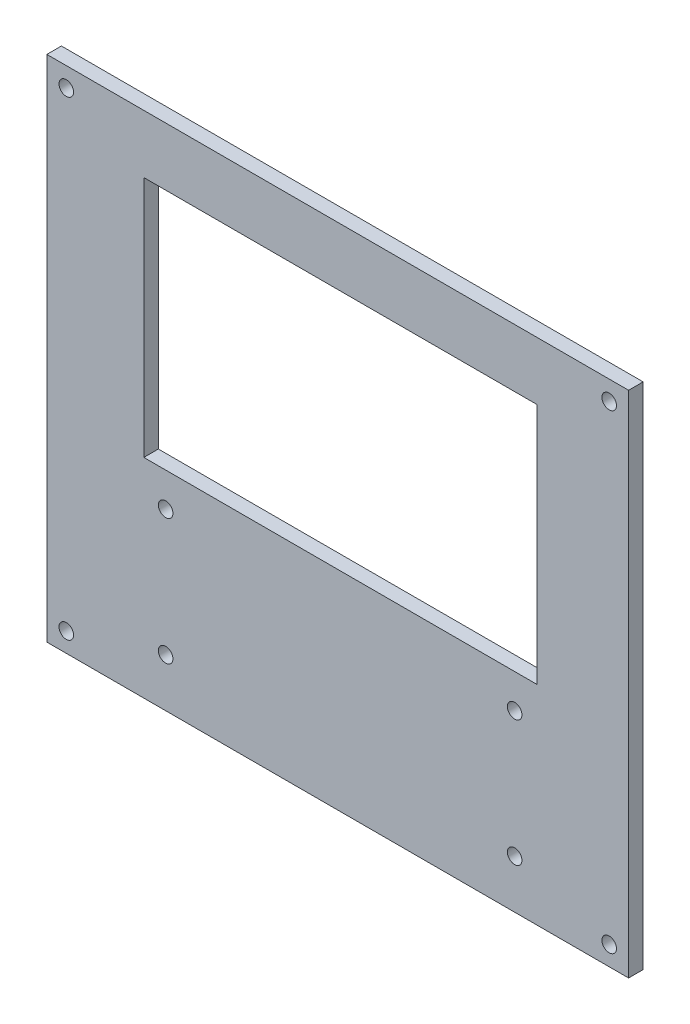
from build123d import *

# Parameters (mm, degrees)
SKETCH_1_W          = 120
SKETCH_1_H          = 105
EXTRUDE_1_DEPTH     = 3
SKETCH_2_R          = 1.5
CUT_EXTRUDE_1_DEPTH = 10
SKETCH_3_R          = 1.5
SKETCH_3_W          = 81.151446905
SKETCH_3_H          = 50
CUT_EXTRUDE_2_DEPTH = 10


with BuildPart() as part:
    # 草图1 → 凸台-拉伸1 (new body)
    with BuildSketch(Plane.XY):
        Rectangle(SKETCH_1_W, SKETCH_1_H)
    extrude(amount=EXTRUDE_1_DEPTH)

    # 草图2 → 切除-拉伸1 (cut)
    with BuildSketch(Plane.XY.offset(3)):
        with Locations((-56, 48.5)):
            Circle(SKETCH_2_R)
        with Locations((56, 48.5)):
            Circle(SKETCH_2_R)
        with Locations((56, -48.5)):
            Circle(SKETCH_2_R)
        with Locations((-56, -48.5)):
            Circle(SKETCH_2_R)
    extrude(amount=-CUT_EXTRUDE_1_DEPTH, mode=Mode.SUBTRACT)

    # 草图3 → 切除-拉伸2 (cut)
    with BuildSketch(Plane(origin=(0, 0, 0), x_dir=(-1, 0, 0), z_dir=(0, 0, -1))):
        with Locations((-36.5, -42.5)):
            Circle(SKETCH_3_R)
        with Locations((35.5, -42.5)):
            Circle(SKETCH_3_R)
        with Locations((-36.5, -16.5)):
            Circle(SKETCH_3_R)
        with Locations((35.5, -16.5)):
            Circle(SKETCH_3_R)
        with Locations((-0.575723453, 15.5)):
            Rectangle(SKETCH_3_W, SKETCH_3_H)
    extrude(amount=-CUT_EXTRUDE_2_DEPTH, mode=Mode.SUBTRACT)


solid = part.part
